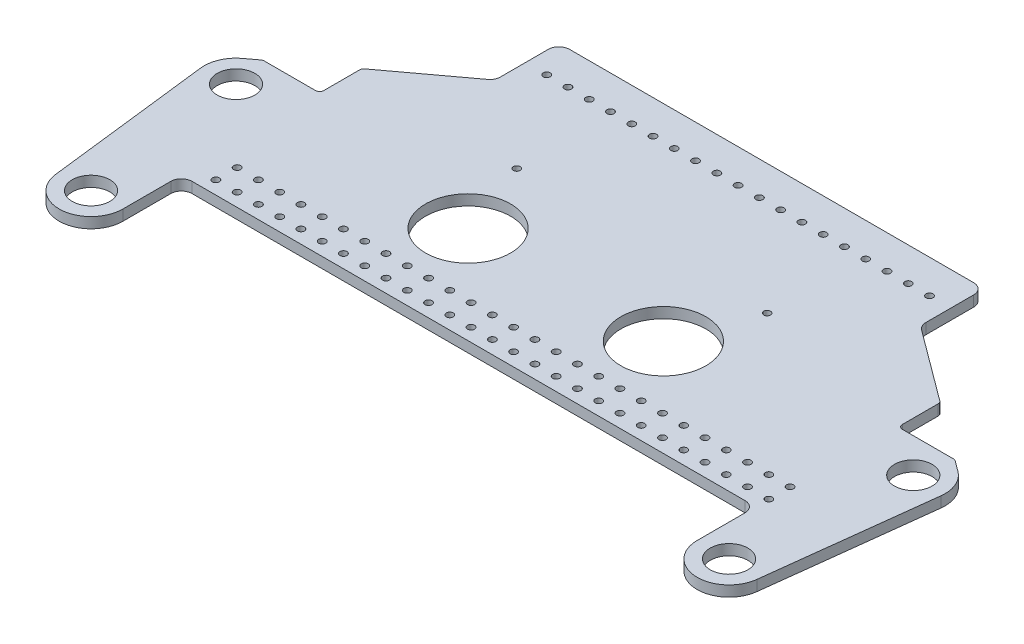
from build123d import *

# Parameters (mm, degrees)
SKETCH1_R           = 2.0193
SKETCH1_R_2         = 11.2395
SKETCH1_R_3         = 25.4
BOSS_EXTRUDE1_DEPTH = 3.175
FILLET1_R           = 6.35
SKETCH2_R           = 2.0828
CUT_EXTRUDE1_DEPTH  = 310.212719881
SKETCH3_R           = 2.0828
CUT_EXTRUDE2_DEPTH  = 310.212719881
CUT_EXTRUDE3_REACH  = 311.213
FILLET2_R           = 2.54


with BuildPart() as part:
    # Sketch1 → Boss-Extrude1 (new, symmetric)
    with BuildSketch(Plane(origin=(0, 0, 0), x_dir=(1, 0, 0), z_dir=(0, 1, 0))):
        with BuildLine():
            Line((-127, 215.9), (127, 215.9))
            Line((127, 215.9), (127, 177.8))
            Line((127, 177.8), (213.56495635, 113.60577834))
            ThreePointArc((213.56495635, 113.60577834), (219.711232803, 105.845797916), (221.133744112, 96.049345906))
            Line((221.133744112, 96.049345906), (209.416092531, -2.254760156))
            ThreePointArc((209.416092531, -2.254760156), (189.370633521, -19.016493666), (171.45, 0))
            Line((171.45, 0), (171.45, 34.925))
            Line((171.45, 34.925), (-171.45, 34.925))
            Line((-171.45, 34.925), (-171.45, 0))
            ThreePointArc((-171.45, 0), (-189.370633521, -19.016493666), (-209.416092531, -2.254760156))
            Line((-209.416092531, -2.254760156), (-221.133744112, 96.049345906))
            ThreePointArc((-221.133744112, 96.049345906), (-219.711232803, 105.845797916), (-213.56495635, 113.60577834))
            Line((-213.56495635, 113.60577834), (-127, 177.8))
            Line((-127, 177.8), (-127, 215.9))
        make_face()
        with Locations(Location((-74.76671991, 138.48842, 0), (0, 0, 270))):
            Circle(SKETCH1_R, mode=Mode.SUBTRACT)
        with Locations(Location((-190.5, 0, 0), (0, 0, 270))):
            Circle(SKETCH1_R_2, mode=Mode.SUBTRACT)
        with Locations(Location((74.76671991, 138.48842, 0), (0, 0, 270))):
            Circle(SKETCH1_R, mode=Mode.SUBTRACT)
        with Locations(Location((190.5, 0, 0), (0, 0, 270))):
            Circle(SKETCH1_R_2, mode=Mode.SUBTRACT)
        with Locations(Location((-202.217651581, 98.304106062, 0), (0, 0, 270))):
            Circle(SKETCH1_R_2, mode=Mode.SUBTRACT)
        with Locations(Location((202.217651581, 98.304106062, 0), (0, 0, 270))):
            Circle(SKETCH1_R_2, mode=Mode.SUBTRACT)
        with Locations(Location((-58.316697469, 92.964, 0), (0, 0, 270))):
            Circle(SKETCH1_R_3, mode=Mode.SUBTRACT)
        with Locations(Location((58.316697469, 92.964, 0), (0, 0, 270))):
            Circle(SKETCH1_R_3, mode=Mode.SUBTRACT)
    extrude(amount=BOSS_EXTRUDE1_DEPTH, both=True)

    # Fillet1
    fillet1_edges = [part.edges().sort_by_distance(p)[0] for p in [
        (171.45, 0, -34.925),
        (-171.45, 0, -34.925),
        (-127, 0, -177.8),
        (-127, 0, -215.9),
        (127, 0, -215.9),
        (127, 0, -177.8),
    ]]
    fillet(fillet1_edges, radius=FILLET1_R)

    # Sketch2 → Cut-Extrude1 (cut, through all)
    with BuildSketch(Plane(origin=(0, 3.175, 0), x_dir=(1, 0, 0), z_dir=(0, 1, 0))):
        with Locations(Location((12.7, 195.904866, 0), (0, 0, 270))):
            Circle(SKETCH2_R)
        with Locations(Location((25.4, 195.904866, 0), (0, 0, 270))):
            Circle(SKETCH2_R)
        with Locations(Location((38.1, 195.904866, 0), (0, 0, 270))):
            Circle(SKETCH2_R)
        with Locations(Location((50.8, 195.904866, 0), (0, 0, 270))):
            Circle(SKETCH2_R)
        with Locations(Location((63.5, 195.904866, 0), (0, 0, 270))):
            Circle(SKETCH2_R)
        with Locations(Location((76.2, 195.904866, 0), (0, 0, 270))):
            Circle(SKETCH2_R)
        with Locations(Location((88.9, 195.904866, 0), (0, 0, 270))):
            Circle(SKETCH2_R)
        with Locations(Location((101.6, 195.904866, 0), (0, 0, 270))):
            Circle(SKETCH2_R)
        with Locations(Location((114.3, 195.904866, 0), (0, 0, 270))):
            Circle(SKETCH2_R)
        with Locations(Location((0, 195.904866, 0), (0, 0, 90))):
            Circle(SKETCH2_R)
        with Locations(Location((-114.3, 195.904866, 0), (0, 0, 90))):
            Circle(SKETCH2_R)
        with Locations(Location((-101.6, 195.904866, 0), (0, 0, 90))):
            Circle(SKETCH2_R)
        with Locations(Location((-88.9, 195.904866, 0), (0, 0, 90))):
            Circle(SKETCH2_R)
        with Locations(Location((-76.2, 195.904866, 0), (0, 0, 90))):
            Circle(SKETCH2_R)
        with Locations(Location((-63.5, 195.904866, 0), (0, 0, 90))):
            Circle(SKETCH2_R)
        with Locations(Location((-50.8, 195.904866, 0), (0, 0, 90))):
            Circle(SKETCH2_R)
        with Locations(Location((-38.1, 195.904866, 0), (0, 0, 90))):
            Circle(SKETCH2_R)
        with Locations(Location((-25.4, 195.904866, 0), (0, 0, 90))):
            Circle(SKETCH2_R)
        with Locations(Location((-12.7, 195.904866, 0), (0, 0, 90))):
            Circle(SKETCH2_R)
    extrude(amount=-CUT_EXTRUDE1_DEPTH, mode=Mode.SUBTRACT)

    # Sketch3 → Cut-Extrude2 (cut, through all)
    with BuildSketch(Plane(origin=(0, 3.175, 0), x_dir=(1, 0, 0), z_dir=(0, 1, 0))):
        with Locations(Location((6.35, 42.799, 0), (0, 0, 270))):
            Circle(SKETCH3_R)
        with Locations(Location((19.05, 42.799, 0), (0, 0, 270))):
            Circle(SKETCH3_R)
        with Locations(Location((31.75, 42.799, 0), (0, 0, 270))):
            Circle(SKETCH3_R)
        with Locations(Location((44.45, 42.799, 0), (0, 0, 270))):
            Circle(SKETCH3_R)
        with Locations(Location((57.15, 42.799, 0), (0, 0, 270))):
            Circle(SKETCH3_R)
        with Locations(Location((69.85, 42.799, 0), (0, 0, 270))):
            Circle(SKETCH3_R)
        with Locations(Location((82.55, 42.799, 0), (0, 0, 270))):
            Circle(SKETCH3_R)
        with Locations(Location((95.25, 42.799, 0), (0, 0, 270))):
            Circle(SKETCH3_R)
        with Locations(Location((107.95, 42.799, 0), (0, 0, 270))):
            Circle(SKETCH3_R)
        with Locations(Location((120.65, 42.799, 0), (0, 0, 270))):
            Circle(SKETCH3_R)
        with Locations(Location((133.35, 42.799, 0), (0, 0, 270))):
            Circle(SKETCH3_R)
        with Locations(Location((146.05, 42.799, 0), (0, 0, 270))):
            Circle(SKETCH3_R)
        with Locations(Location((158.75, 42.799, 0), (0, 0, 270))):
            Circle(SKETCH3_R)
        with Locations(Location((171.45, 42.799, 0), (0, 0, 270))):
            Circle(SKETCH3_R)
        with Locations(Location((19.05, 55.499, 0), (0, 0, 270))):
            Circle(SKETCH3_R)
        with Locations(Location((31.75, 55.499, 0), (0, 0, 270))):
            Circle(SKETCH3_R)
        with Locations(Location((44.45, 55.499, 0), (0, 0, 270))):
            Circle(SKETCH3_R)
        with Locations(Location((57.15, 55.499, 0), (0, 0, 270))):
            Circle(SKETCH3_R)
        with Locations(Location((69.85, 55.499, 0), (0, 0, 270))):
            Circle(SKETCH3_R)
        with Locations(Location((82.55, 55.499, 0), (0, 0, 270))):
            Circle(SKETCH3_R)
        with Locations(Location((95.25, 55.499, 0), (0, 0, 270))):
            Circle(SKETCH3_R)
        with Locations(Location((107.95, 55.499, 0), (0, 0, 270))):
            Circle(SKETCH3_R)
        with Locations(Location((120.65, 55.499, 0), (0, 0, 270))):
            Circle(SKETCH3_R)
        with Locations(Location((133.35, 55.499, 0), (0, 0, 270))):
            Circle(SKETCH3_R)
        with Locations(Location((146.05, 55.499, 0), (0, 0, 270))):
            Circle(SKETCH3_R)
        with Locations(Location((158.75, 55.499, 0), (0, 0, 270))):
            Circle(SKETCH3_R)
        with Locations(Location((171.45, 55.499, 0), (0, 0, 270))):
            Circle(SKETCH3_R)
        with Locations(Location((6.35, 55.499, 0), (0, 0, 270))):
            Circle(SKETCH3_R)
        with Locations(Location((-158.75, 55.499, 0), (0, 0, 90))):
            Circle(SKETCH3_R)
        with Locations(Location((-146.05, 55.499, 0), (0, 0, 90))):
            Circle(SKETCH3_R)
        with Locations(Location((-133.35, 55.499, 0), (0, 0, 90))):
            Circle(SKETCH3_R)
        with Locations(Location((-120.65, 55.499, 0), (0, 0, 90))):
            Circle(SKETCH3_R)
        with Locations(Location((-107.95, 55.499, 0), (0, 0, 90))):
            Circle(SKETCH3_R)
        with Locations(Location((-95.25, 55.499, 0), (0, 0, 90))):
            Circle(SKETCH3_R)
        with Locations(Location((-82.55, 55.499, 0), (0, 0, 90))):
            Circle(SKETCH3_R)
        with Locations(Location((-69.85, 55.499, 0), (0, 0, 90))):
            Circle(SKETCH3_R)
        with Locations(Location((-57.15, 55.499, 0), (0, 0, 90))):
            Circle(SKETCH3_R)
        with Locations(Location((-44.45, 55.499, 0), (0, 0, 90))):
            Circle(SKETCH3_R)
        with Locations(Location((-31.75, 55.499, 0), (0, 0, 90))):
            Circle(SKETCH3_R)
        with Locations(Location((-19.05, 55.499, 0), (0, 0, 90))):
            Circle(SKETCH3_R)
        with Locations(Location((-6.35, 55.499, 0), (0, 0, 90))):
            Circle(SKETCH3_R)
        with Locations(Location((-158.75, 42.799, 0), (0, 0, 90))):
            Circle(SKETCH3_R)
        with Locations(Location((-146.05, 42.799, 0), (0, 0, 90))):
            Circle(SKETCH3_R)
        with Locations(Location((-133.35, 42.799, 0), (0, 0, 90))):
            Circle(SKETCH3_R)
        with Locations(Location((-120.65, 42.799, 0), (0, 0, 90))):
            Circle(SKETCH3_R)
        with Locations(Location((-107.95, 42.799, 0), (0, 0, 90))):
            Circle(SKETCH3_R)
        with Locations(Location((-95.25, 42.799, 0), (0, 0, 90))):
            Circle(SKETCH3_R)
        with Locations(Location((-82.55, 42.799, 0), (0, 0, 90))):
            Circle(SKETCH3_R)
        with Locations(Location((-69.85, 42.799, 0), (0, 0, 90))):
            Circle(SKETCH3_R)
        with Locations(Location((-57.15, 42.799, 0), (0, 0, 90))):
            Circle(SKETCH3_R)
        with Locations(Location((-44.45, 42.799, 0), (0, 0, 90))):
            Circle(SKETCH3_R)
        with Locations(Location((-31.75, 42.799, 0), (0, 0, 90))):
            Circle(SKETCH3_R)
        with Locations(Location((-19.05, 42.799, 0), (0, 0, 90))):
            Circle(SKETCH3_R)
        with Locations(Location((-6.35, 42.799, 0), (0, 0, 90))):
            Circle(SKETCH3_R)
    extrude(amount=-CUT_EXTRUDE2_DEPTH, mode=Mode.SUBTRACT)

    # Sketch4 → Cut-Extrude3 (cut, up to next)
    with BuildSketch(Plane(origin=(0, 3.175, 0), x_dir=(1, 0, 0), z_dir=(0, 1, 0)), mode=Mode.PRIVATE) as cut_extrude3_sk1:
        Polygon((-172.72, 143.895289156), (-172.72, 118.745), (-206.63479212, 118.745), align=None)
    cut_extrude3_tool1 = extrude(cut_extrude3_sk1.sketch, amount=-CUT_EXTRUDE3_REACH, mode=Mode.PRIVATE) & part.part
    # Sketch4 → Cut-Extrude3 (cut, up to next)
    with BuildSketch(Plane(origin=(0, 3.175, 0), x_dir=(1, 0, 0), z_dir=(0, 1, 0)), mode=Mode.PRIVATE) as cut_extrude3_sk2:
        Polygon((172.72, 118.745), (206.63479212, 118.745), (172.72, 143.895289156), align=None)
    cut_extrude3_tool2 = extrude(cut_extrude3_sk2.sketch, amount=-CUT_EXTRUDE3_REACH, mode=Mode.PRIVATE) & part.part
    add(cut_extrude3_tool1.solids().sort_by_distance((-184.024931, 3.175, -127.12843))[0], mode=Mode.SUBTRACT)
    add(cut_extrude3_tool2.solids().sort_by_distance((184.024931, 3.175, -127.12843))[0], mode=Mode.SUBTRACT)

    # Fillet2
    fillet2_edges = [part.edges().sort_by_distance(p)[0] for p in [
        (-206.63479212, 0, -118.745),
        (-172.72, 0, -143.895289156),
        (-172.72, 0, -118.745),
        (172.72, 0, -118.745),
        (172.72, 0, -143.895289156),
        (206.63479212, 0, -118.745),
    ]]
    fillet(fillet2_edges, radius=FILLET2_R)


solid = part.part
